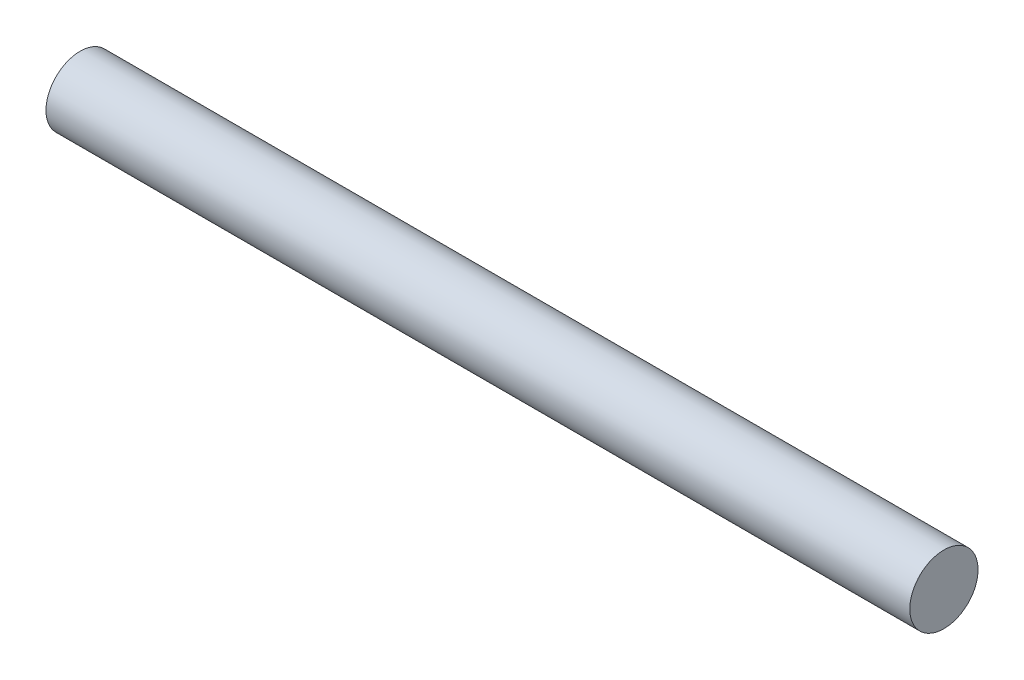
from build123d import *

# Parameters (mm, degrees)
SKIZZE1_R                       = 3.675
AUFSATZ_LINEAR_AUSTRAGEN1_DEPTH = 93


with BuildPart() as part:
    # Skizze1 → Aufsatz-Linear austragen1 (new body)
    with BuildSketch(Plane.YZ):
        with Locations(Location((0, 0, 0), (0, 0, 90))):
            Circle(SKIZZE1_R)
    extrude(amount=AUFSATZ_LINEAR_AUSTRAGEN1_DEPTH)


solid = part.part
